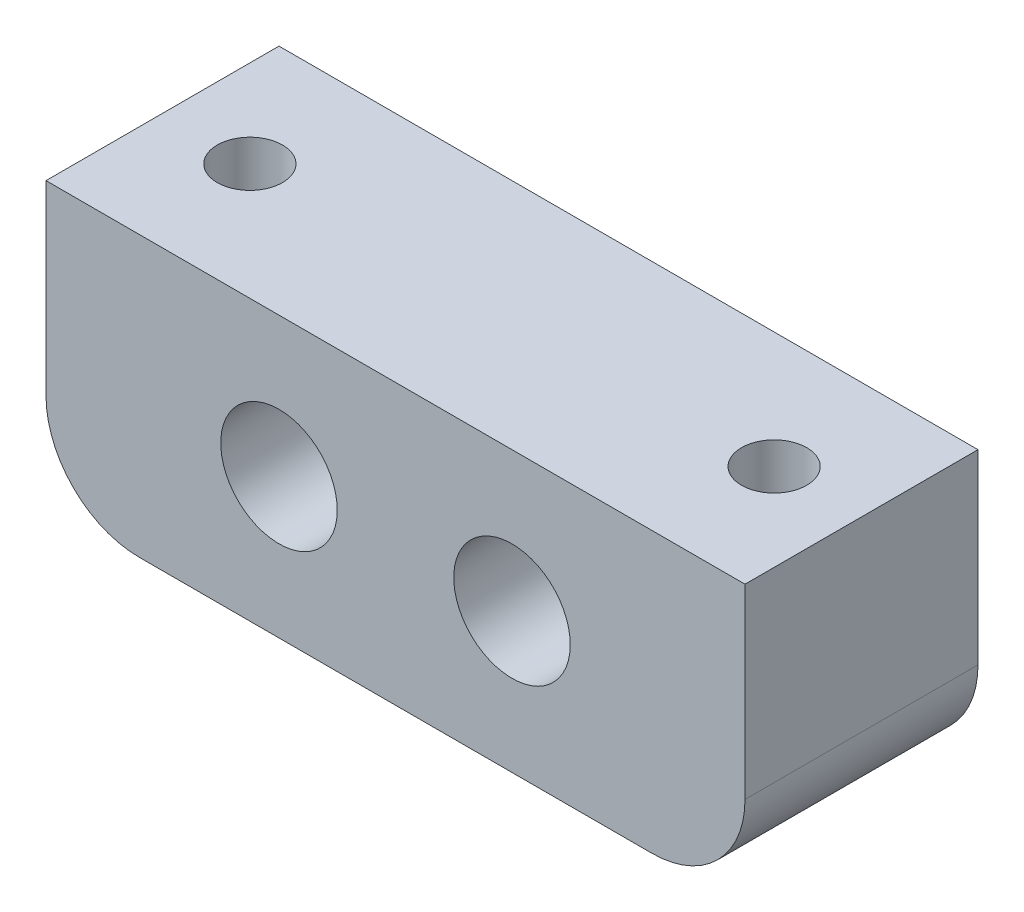
from build123d import *

# Parameters (mm, degrees)
SKETCH1_R           = 1.5875
BOSS_EXTRUDE1_DEPTH = 6.35
SKETCH2_R           = 0.889
CUT_EXTRUDE1_DEPTH  = 6.35


with BuildPart() as part:
    # Sketch1 → Boss-Extrude1 (new body)
    with BuildSketch(Plane.XY):
        with BuildLine():
            Line((-6.193204917, -0.093500134), (12.856795083, -0.093500134))
            Line((12.856795083, -0.093500134), (12.856795083, -5.173500134))
            ThreePointArc((12.856795083, -5.173500134), (12.112846307, -6.969551358), (10.316795083, -7.713500134))
            Line((10.316795083, -7.713500134), (-3.653204917, -7.713500134))
            ThreePointArc((-3.653204917, -7.713500134), (-5.449256142, -6.969551358), (-6.193204917, -5.173500134))
            Line((-6.193204917, -5.173500134), (-6.193204917, -0.093500134))
        make_face()
        with Locations((0.156795083, -3.903500134)):
            Circle(SKETCH1_R, mode=Mode.SUBTRACT)
        with Locations((6.506795083, -3.903500134)):
            Circle(SKETCH1_R, mode=Mode.SUBTRACT)
    extrude(amount=BOSS_EXTRUDE1_DEPTH)

    # Sketch2 → Cut-Extrude1 (cut)
    with BuildSketch(Plane(origin=(0, -0.093500134, 0), x_dir=(1, 0, 0), z_dir=(0, 1, 0))):
        with Locations(Location((-3.811954917, -3.175, 0), (0, 0, 180))):
            Circle(SKETCH2_R)
        with Locations(Location((10.475545083, -3.175, 0), (0, 0, 180))):
            Circle(SKETCH2_R)
    extrude(amount=-CUT_EXTRUDE1_DEPTH, mode=Mode.SUBTRACT)


solid = part.part
